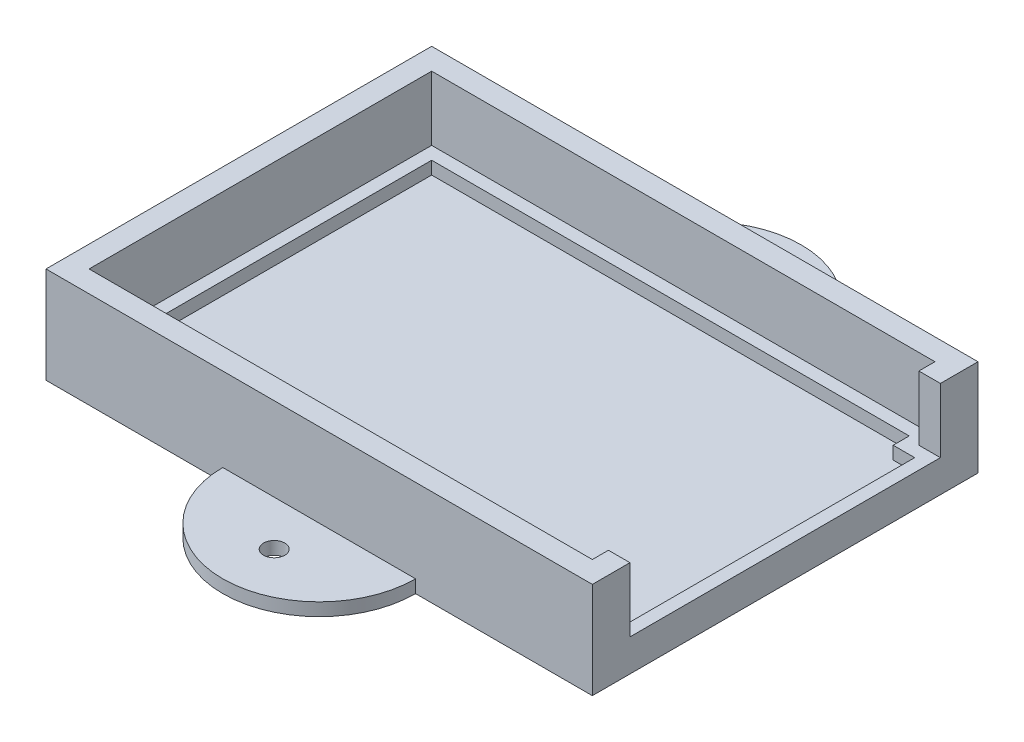
from build123d import *

# Parameters (mm, degrees)
CROQUIS2_W              = 85
CROQUIS2_H              = 60
SALIENTE_EXTRUIR1_DEPTH = 15
VACIADO1_T              = -3
CROQUIS3_W              = 79
CROQUIS3_H              = 54
CROQUIS3_W_2            = 78.3
CROQUIS3_H_2            = 53.3
SALIENTE_EXTRUIR2_DEPTH = 12
CROQUIS6_W              = 3.35
CROQUIS6_H              = 48.3
CORTAR_EXTRUIR2_DEPTH   = 12
SALIENTE_EXTRUIR4_DEPTH = 2
SALIENTE_EXTRUIR5_DEPTH = 2
CROQUIS9_R              = 1.65
CORTAR_EXTRUIR3_DEPTH   = 21


with BuildPart() as part:
    # Croquis2 → Saliente-Extruir1 (new body)
    with BuildSketch(Plane(origin=(0, 0, 0), x_dir=(1, 0, 0), z_dir=(0, 1, 0))):
        Rectangle(CROQUIS2_W, CROQUIS2_H)
    extrude(amount=SALIENTE_EXTRUIR1_DEPTH)

    # Vaciado1
    vaciado1_openings = [part.faces().sort_by_distance(p)[0] for p in [
        (0, 15, 0),
    ]]
    offset(amount=VACIADO1_T, openings=vaciado1_openings, kind=Kind.INTERSECTION)

    # Croquis3 → Saliente-Extruir2 (add)
    with BuildSketch(Plane(origin=(0, 3, 0), x_dir=(1, 0, 0), z_dir=(0, 1, 0))):
        Rectangle(CROQUIS3_W, CROQUIS3_H)
        Rectangle(CROQUIS3_W_2, CROQUIS3_H_2, mode=Mode.SUBTRACT)
    extrude(amount=SALIENTE_EXTRUIR2_DEPTH)

    # Croquis6 → Cortar-Extruir2 (cut)
    with BuildSketch(Plane(origin=(0, 15, 0), x_dir=(1, 0, 0), z_dir=(0, 1, 0))):
        with Locations((40.825, 0)):
            Rectangle(CROQUIS6_W, CROQUIS6_H)
    extrude(amount=-CORTAR_EXTRUIR2_DEPTH, mode=Mode.SUBTRACT)

    # Croquis7 → Saliente-Extruir4 (add)
    with BuildSketch(Plane(origin=(0, 3, 0), x_dir=(1, 0, 0), z_dir=(0, 1, 0))):
        Polygon((39.15, -26.65), (39.15, -24.15), (42.5, -24.15), (42.5, 24.15), (39.15, 24.15), (39.15, 26.65), (-39.15, 26.65), (-39.15, -26.65), align=None)
        Polygon((37.15, -24.65), (37.15, -22.15), (40.5, -22.15), (40.5, 22.15), (37.15, 22.15), (37.15, 24.65), (-37.15, 24.65), (-37.15, -24.65), align=None, mode=Mode.SUBTRACT)
    extrude(amount=SALIENTE_EXTRUIR4_DEPTH)

    # Croquis8 → Saliente-Extruir5 (add)
    with BuildSketch(Plane.XZ):
        with BuildLine():
            Line((-15, -30), (-15, 30))
            ThreePointArc((-15, 30), (0, 45), (15, 30))
            Line((15, 30), (15, -30))
            ThreePointArc((15, -30), (0, -45), (-15, -30))
        make_face()
    extrude(amount=-SALIENTE_EXTRUIR5_DEPTH)

    # Croquis9 → Cortar-Extruir3 (cut)
    with BuildSketch(Plane(origin=(0, 2, 0), x_dir=(1, 0, 0), z_dir=(0, 1, 0))):
        with Locations(Location((0, 37, 0), (0, 0, 270))):
            Circle(CROQUIS9_R)
        with Locations(Location((0, -37, 0), (0, 0, 270))):
            Circle(CROQUIS9_R)
    extrude(amount=-CORTAR_EXTRUIR3_DEPTH, mode=Mode.SUBTRACT)


solid = part.part
